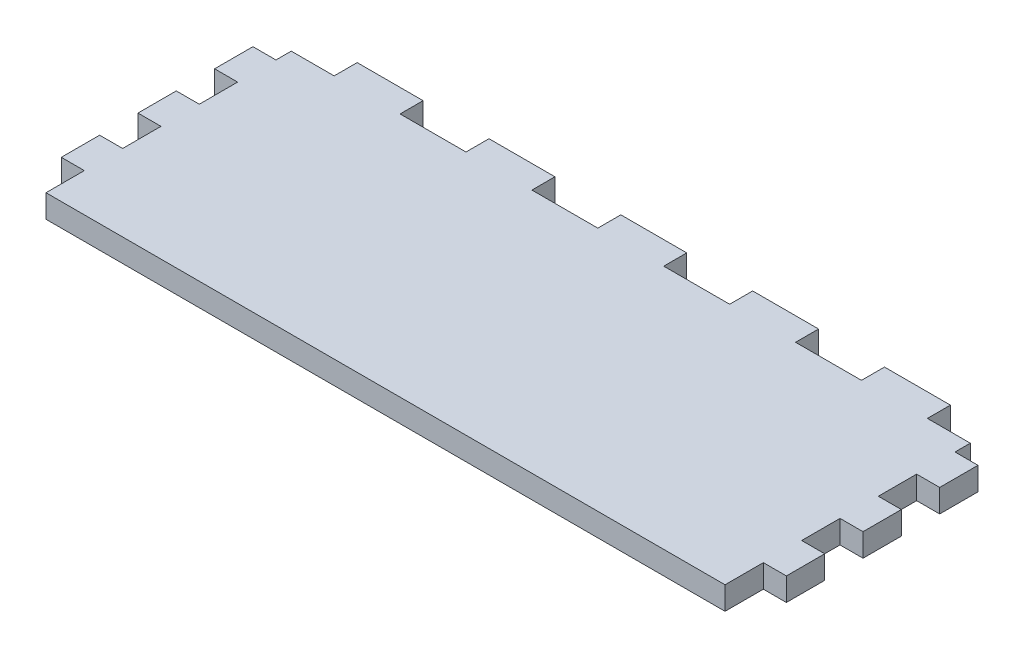
from build123d import *

# Parameters (mm, degrees)
ESQUISSE1_W             = 200
ESQUISSE1_H             = 74
BOSS_EXTRU_1_DEPTH      = 6.35
ESQUISSE2_W             = 6.35
ESQUISSE2_H             = 10.571428571
ENL_V_MAT_EXTRU_1_DEPTH = 6.35
ESQUISSE3_W             = 18.181818182
ESQUISSE3_H             = 6.35
ESQUISSE3_W_2           = 18.181818181
ENL_V_MAT_EXTRU_2_DEPTH = 6.35


with BuildPart() as part:
    # Esquisse1 → Boss.-Extru.1 (new body)
    with BuildSketch(Plane(origin=(0, 0, 0), x_dir=(1, 0, 0), z_dir=(0, 1, 0))):
        with Locations((0, 37)):
            Rectangle(ESQUISSE1_W, ESQUISSE1_H)
    extrude(amount=BOSS_EXTRU_1_DEPTH)

    # Esquisse2 → Enlèv. mat.-Extru.1 (cut)
    with BuildSketch(Plane(origin=(0, 6.35, 0), x_dir=(1, 0, 0), z_dir=(0, 1, 0))):
        with Locations((96.825, 68.714285714)):
            Rectangle(ESQUISSE2_W, ESQUISSE2_H)
        with Locations((96.825, 47.571428572)):
            Rectangle(ESQUISSE2_W, ESQUISSE2_H)
        with Locations((96.825, 26.428571428)):
            Rectangle(ESQUISSE2_W, ESQUISSE2_H)
        with Locations((96.825, 5.285714286)):
            Rectangle(ESQUISSE2_W, ESQUISSE2_H)
    enl_v_mat_extru_1 = extrude(amount=-ENL_V_MAT_EXTRU_1_DEPTH, mode=Mode.SUBTRACT)

    # Symétrie1: Enlèv. mat.-Extru.1 across plane
    add(enl_v_mat_extru_1.mirror(Plane(origin=(0, 0, 0), x_dir=(0, 0, 1), z_dir=(1, 0, 0))), mode=Mode.SUBTRACT)

    # Esquisse3 → Enlèv. mat.-Extru.2 (cut)
    with BuildSketch(Plane(origin=(0, 6.35, 0), x_dir=(1, 0, 0), z_dir=(0, 1, 0))):
        with Locations((-90.909090909, 70.825)):
            Rectangle(ESQUISSE3_W, ESQUISSE3_H)
        with Locations((-54.545454546, 70.825)):
            Rectangle(ESQUISSE3_W_2, ESQUISSE3_H)
        with Locations((-18.181818182, 70.825)):
            Rectangle(ESQUISSE3_W, ESQUISSE3_H)
        with Locations((18.181818182, 70.825)):
            Rectangle(ESQUISSE3_W, ESQUISSE3_H)
        with Locations((54.545454546, 70.825)):
            Rectangle(ESQUISSE3_W_2, ESQUISSE3_H)
        with Locations((90.909090909, 70.825)):
            Rectangle(ESQUISSE3_W, ESQUISSE3_H)
    extrude(amount=-ENL_V_MAT_EXTRU_2_DEPTH, mode=Mode.SUBTRACT)


solid = part.part
